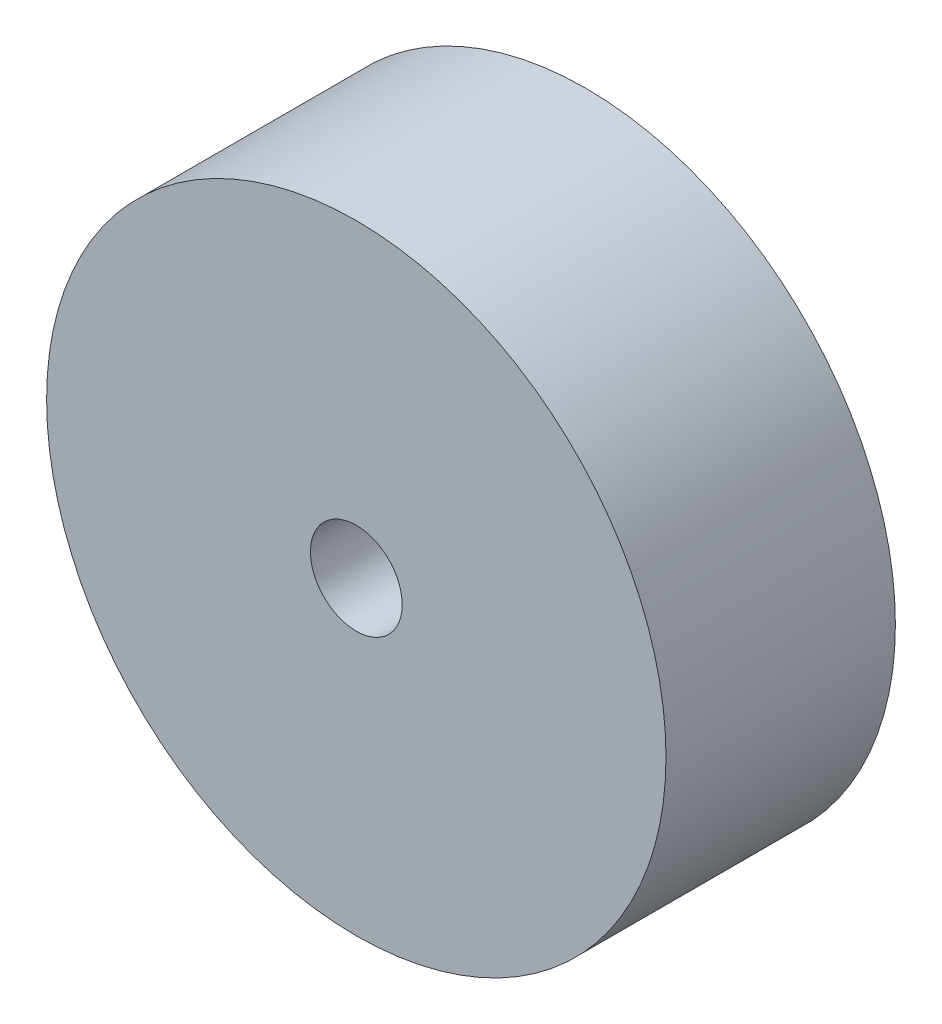
from build123d import *

# Parameters (mm, degrees)
ESQUISSE2_R        = 6.75
ESQUISSE2_R_2      = 1
BOSS_EXTRU_1_DEPTH = 5


with BuildPart() as part:
    # Esquisse2 → Boss.-Extru.1 (new body)
    with BuildSketch(Plane.XY):
        Circle(ESQUISSE2_R)
        Circle(ESQUISSE2_R_2, mode=Mode.SUBTRACT)
    extrude(amount=BOSS_EXTRU_1_DEPTH)


solid = part.part
